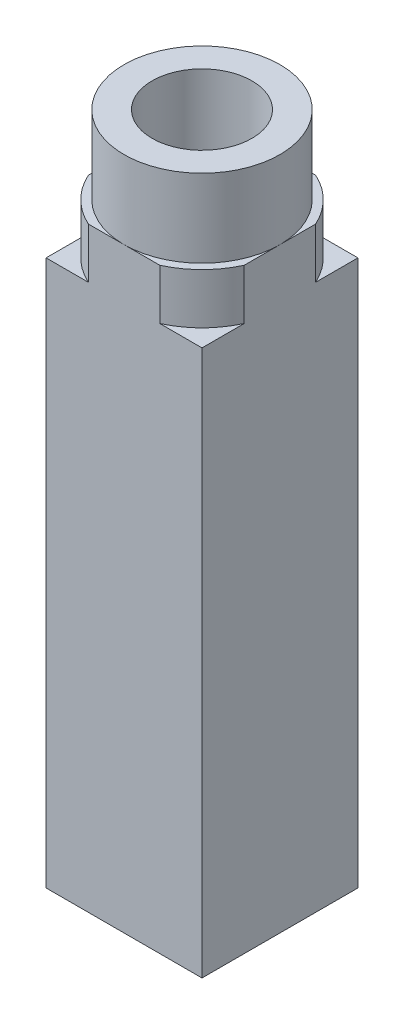
from build123d import *

# Parameters (mm, degrees)
SKETCH1_W           = 6.35
SKETCH1_H           = 6.35
BOSS_EXTRUDE1_DEPTH = 22.225
SKETCH2_R           = 3.175
BOSS_EXTRUDE2_DEPTH = 27.45486
BOSS_EXTRUDE3_DEPTH = 2.05486
SKETCH5_R           = 1.984375
CUT_EXTRUDE1_DEPTH  = 12.7
SKETCH6_R           = 2.032
CUT_EXTRUDE2_DEPTH  = 12.7


with BuildPart() as part:
    # Sketch1 → Boss-Extrude1 (new body)
    with BuildSketch(Plane(origin=(0, 0, 0), x_dir=(1, 0, 0), z_dir=(0, 1, 0))):
        Rectangle(SKETCH1_W, SKETCH1_H)
    extrude(amount=BOSS_EXTRUDE1_DEPTH)

    # Sketch2 → Boss-Extrude2 (add)
    with BuildSketch(Plane.XZ):
        with Locations(Location((0, 0, 0), (0, 0, 270))):
            Circle(SKETCH2_R)
    extrude(amount=-BOSS_EXTRUDE2_DEPTH)

    # Sketch4 → Boss-Extrude3 (add)
    with BuildSketch(Plane(origin=(0, 24.27986, 0), x_dir=(1, 0, 0), z_dir=(0, 1, 0))):
        with BuildLine():
            Line((-3.175, 0), (-3.175, -1.454967783))
            ThreePointArc((-3.175, -1.454967783), (-2.469570433, -2.469570433), (-1.454967783, -3.175))
            Line((-1.454967783, -3.175), (0, -3.175))
            Line((0, -3.175), (1.454967783, -3.175))
            ThreePointArc((1.454967783, -3.175), (2.469570433, -2.469570433), (3.175, -1.454967783))
            Line((3.175, -1.454967783), (3.175, 0))
            Line((3.175, 0), (3.175, 1.454967783))
            ThreePointArc((3.175, 1.454967783), (2.469570433, 2.469570433), (1.454967783, 3.175))
            Line((1.454967783, 3.175), (0, 3.175))
            Line((0, 3.175), (-1.454967783, 3.175))
            ThreePointArc((-1.454967783, 3.175), (-2.469570433, 2.469570433), (-3.175, 1.454967783))
            Line((-3.175, 1.454967783), (-3.175, 0))
        make_face()
    extrude(amount=-BOSS_EXTRUDE3_DEPTH)

    # Sketch5 → Cut-Extrude1 (cut)
    with BuildSketch(Plane.XZ):
        with Locations(Location((0, 0, 0), (0, 0, 270))):
            Circle(SKETCH5_R)
    extrude(amount=-CUT_EXTRUDE1_DEPTH, mode=Mode.SUBTRACT)

    # Sketch6 → Cut-Extrude2 (cut)
    with BuildSketch(Plane(origin=(0, 27.45486, 0), x_dir=(1, 0, 0), z_dir=(0, 1, 0))):
        with Locations(Location((0, 0, 0), (0, 0, 270))):
            Circle(SKETCH6_R)
    extrude(amount=-CUT_EXTRUDE2_DEPTH, mode=Mode.SUBTRACT)


solid = part.part
